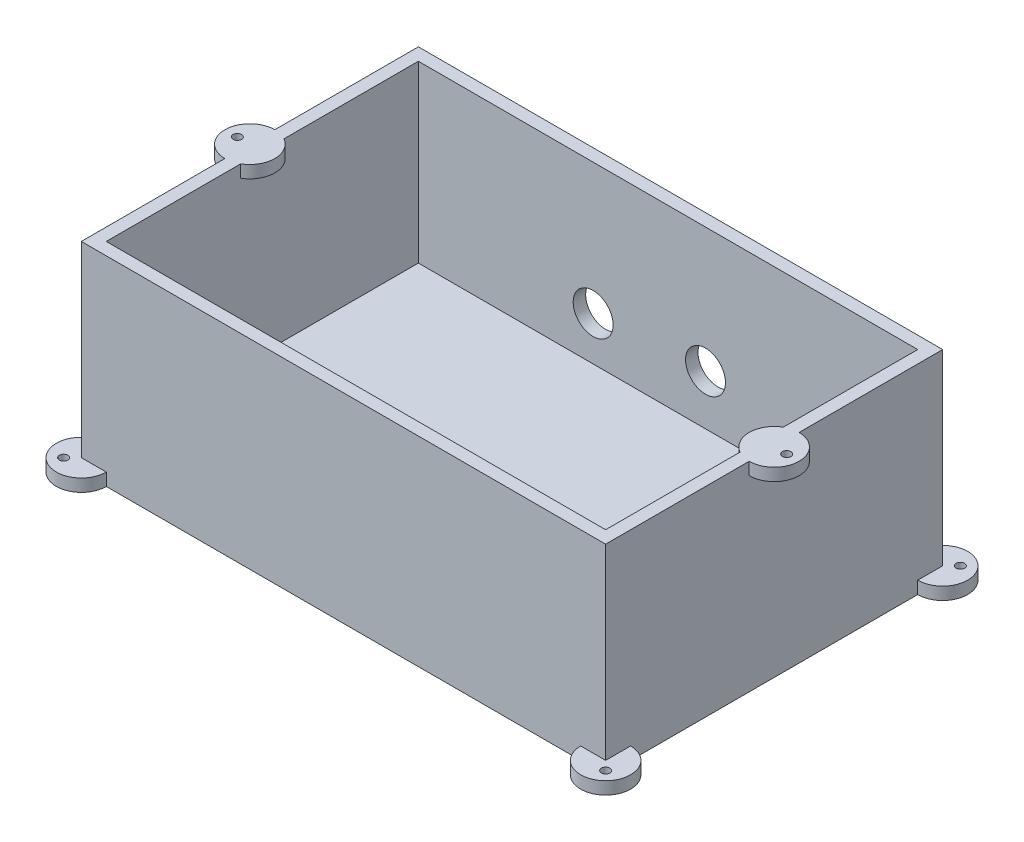
from build123d import *

# Parameters (mm, degrees)
SKETCH1_W           = 200
SKETCH1_H           = 125
BOSS_EXTRUDE1_DEPTH = 70
SKETCH2_W           = 210
SKETCH2_H           = 135
BOSS_EXTRUDE2_DEPTH = 10
SKETCH3_R           = 10
BOSS_EXTRUDE5_DEPTH = 5
CUT_EXTRUDE2_DEPTH  = 5
CUT_EXTRUDE3_DEPTH  = 10
SKETCH10_W          = 10
SKETCH10_H          = 125
CUT_EXTRUDE4_DEPTH  = 10
BOSS_EXTRUDE6_DEPTH = 5
SKETCH12_R          = 8
CUT_EXTRUDE5_DEPTH  = 10


with BuildPart() as part:
    # Sketch1 → Boss-Extrude1 (new body)
    with BuildSketch(Plane(origin=(0, 0, 0), x_dir=(1, 0, 0), z_dir=(0, 1, 0))):
        Polygon((210, 0), (0, 0), (0, -135), (5, -135), (210, -135), align=None)
        with Locations((105, -67.5)):
            Rectangle(SKETCH1_W, SKETCH1_H, mode=Mode.SUBTRACT)
    extrude(amount=BOSS_EXTRUDE1_DEPTH)

    # Sketch2 → Boss-Extrude2 (add)
    with BuildSketch(Plane(origin=(0, 0, 0), x_dir=(-1, 0, 0), z_dir=(0, -1, 0))):
        with Locations((-105, -67.5)):
            Rectangle(SKETCH2_W, SKETCH2_H)
    extrude(amount=BOSS_EXTRUDE2_DEPTH)

    # Sketch3 → Boss-Extrude5 (add)
    with BuildSketch(Plane(origin=(0, -10, 0), x_dir=(-1, 0, 0), z_dir=(0, -1, 0))):
        with Locations((-210, 0)):
            Circle(SKETCH3_R)
        Circle(SKETCH3_R)
        with Locations((0, -135)):
            Circle(SKETCH3_R)
        with Locations((-210, -135)):
            Circle(SKETCH3_R)
    extrude(amount=-BOSS_EXTRUDE5_DEPTH)

    # Sketch7 → Cut-Extrude2 (cut)
    with BuildSketch(Plane(origin=(0, -5, 0), x_dir=(1, 0, 0), z_dir=(0, 1, 0))):
        with BuildLine():
            ThreePointArc((215.235533906, -138.535533906), (214.186095741, -136.964938701), (212.333452378, -137.333452378))
            Line((212.333452378, -137.333452378), (214.737615434, -139.737615434))
            ThreePointArc((214.737615434, -139.737615434), (215.106129111, -139.186095741), (215.235533906, -138.535533906))
        make_face()
        with BuildLine():
            Line((214.737615434, -139.737615434), (212.333452378, -137.333452378))
            ThreePointArc((212.333452378, -137.333452378), (212.333452378, -139.737615434), (214.737615434, -139.737615434))
        make_face()
        with BuildLine():
            ThreePointArc((214.737615434, 4.737615434), (212.333452378, 4.737615434), (212.333452378, 2.333452378))
            Line((212.333452378, 2.333452378), (214.737615434, 4.737615434))
        make_face()
        with BuildLine():
            Line((214.737615434, 4.737615434), (212.333452378, 2.333452378))
            ThreePointArc((212.333452378, 2.333452378), (214.186095741, 1.964938701), (215.235533906, 3.535533906))
            ThreePointArc((215.235533906, 3.535533906), (215.106129111, 4.186095741), (214.737615434, 4.737615434))
        make_face()
        with BuildLine():
            ThreePointArc((-4.737615434, 4.737615434), (-4.737615434, 2.333452378), (-2.333452378, 2.333452378))
            Line((-2.333452378, 2.333452378), (-4.737615434, 4.737615434))
        make_face()
        with BuildLine():
            Line((-4.737615434, 4.737615434), (-2.333452378, 2.333452378))
            ThreePointArc((-2.333452378, 2.333452378), (-1.964938701, 2.884972071), (-1.835533906, 3.535533906))
            ThreePointArc((-1.835533906, 3.535533906), (-2.884972071, 5.106129111), (-4.737615434, 4.737615434))
        make_face()
        with BuildLine():
            ThreePointArc((-1.835533906, -138.535533906), (-1.964938701, -137.884972071), (-2.333452378, -137.333452378))
            Line((-2.333452378, -137.333452378), (-4.737615434, -139.737615434))
            ThreePointArc((-4.737615434, -139.737615434), (-2.884972071, -140.106129111), (-1.835533906, -138.535533906))
        make_face()
        with BuildLine():
            Line((-4.737615434, -139.737615434), (-2.333452378, -137.333452378))
            ThreePointArc((-2.333452378, -137.333452378), (-4.737615434, -137.333452378), (-4.737615434, -139.737615434))
        make_face()
    extrude(amount=-CUT_EXTRUDE2_DEPTH, mode=Mode.SUBTRACT)

    # Sketch9 → Cut-Extrude3 (cut)
    with BuildSketch(Plane(origin=(0, 0, 0), x_dir=(1, 0, 0), z_dir=(0, 1, 0))):
        Polygon((195, -130), (200, -125), (205, -120), (205, -15), (200, -10), (195, -5), align=None)
    extrude(amount=-CUT_EXTRUDE3_DEPTH, mode=Mode.SUBTRACT)

    # Sketch10 → Cut-Extrude4 (cut)
    with BuildSketch(Plane(origin=(0, 0, 0), x_dir=(1, 0, 0), z_dir=(0, 1, 0))):
        with Locations((190, -67.5)):
            Rectangle(SKETCH10_W, SKETCH10_H)
    extrude(amount=-CUT_EXTRUDE4_DEPTH, mode=Mode.SUBTRACT)

    # Sketch11 → Boss-Extrude6 (add)
    with BuildSketch(Plane(origin=(0, 70, 0), x_dir=(1, 0, 0), z_dir=(0, 1, 0))):
        with BuildLine():
            ThreePointArc((213.3, -67.5), (215, -65.8), (216.7, -67.5))
            Line((216.7, -67.5), (220, -67.5))
            ThreePointArc((220, -67.5), (217.071067812, -60.428932188), (210, -57.5))
            Line((210, -57.5), (210, -67.5))
            Line((210, -67.5), (213.3, -67.5))
        make_face()
        with BuildLine():
            Line((220, -67.5), (216.7, -67.5))
            ThreePointArc((216.7, -67.5), (215, -69.2), (213.3, -67.5))
            Line((213.3, -67.5), (210, -67.5))
            Line((210, -67.5), (210, -77.5))
            ThreePointArc((210, -77.5), (217.071067812, -74.571067812), (220, -67.5))
        make_face()
        with BuildLine():
            Line((205, -76.160254038), (205, -58.839745962))
            ThreePointArc((205, -58.839745962), (200, -67.5), (205, -76.160254038))
        make_face()
        with BuildLine():
            Line((210, -67.5), (210, -57.5))
            ThreePointArc((210, -57.5), (207.411809549, -57.840741737), (205, -58.839745962))
            Line((205, -58.839745962), (205, -76.160254038))
            ThreePointArc((205, -76.160254038), (207.411809549, -77.159258263), (210, -77.5))
            Line((210, -77.5), (210, -67.5))
        make_face()
        with BuildLine():
            ThreePointArc((10, -67.5), (8.660254038, -62.5), (5, -58.839745962))
            Line((5, -58.839745962), (5, -76.160254038))
            ThreePointArc((5, -76.160254038), (8.660254038, -72.5), (10, -67.5))
        make_face()
        with BuildLine():
            Line((0, -57.5), (0, -67.5))
            Line((0, -67.5), (0, -77.5))
            ThreePointArc((0, -77.5), (2.588190451, -77.159258263), (5, -76.160254038))
            Line((5, -76.160254038), (5, -58.839745962))
            ThreePointArc((5, -58.839745962), (2.588190451, -57.840741737), (0, -57.5))
        make_face()
        with BuildLine():
            Line((0, -77.5), (0, -67.5))
            Line((0, -67.5), (-3.3, -67.5))
            ThreePointArc((-3.3, -67.5), (-5, -69.2), (-6.7, -67.5))
            Line((-6.7, -67.5), (-10, -67.5))
            ThreePointArc((-10, -67.5), (-7.071067812, -74.571067812), (0, -77.5))
        make_face()
        with BuildLine():
            Line((-3.3, -67.5), (0, -67.5))
            Line((0, -67.5), (0, -57.5))
            ThreePointArc((0, -57.5), (-7.071067812, -60.428932188), (-10, -67.5))
            Line((-10, -67.5), (-6.7, -67.5))
            ThreePointArc((-6.7, -67.5), (-5, -65.8), (-3.3, -67.5))
        make_face()
    extrude(amount=-BOSS_EXTRUDE6_DEPTH)

    # Sketch12 → Cut-Extrude5 (cut)
    with BuildSketch(Plane(origin=(0, 0, 0), x_dir=(-1, 0, 0), z_dir=(0, 0, -1))):
        with Locations((-75, 17.5)):
            Circle(SKETCH12_R)
        with Locations((-120, 20)):
            Circle(SKETCH12_R)
    extrude(amount=-CUT_EXTRUDE5_DEPTH, mode=Mode.SUBTRACT)


solid = part.part
